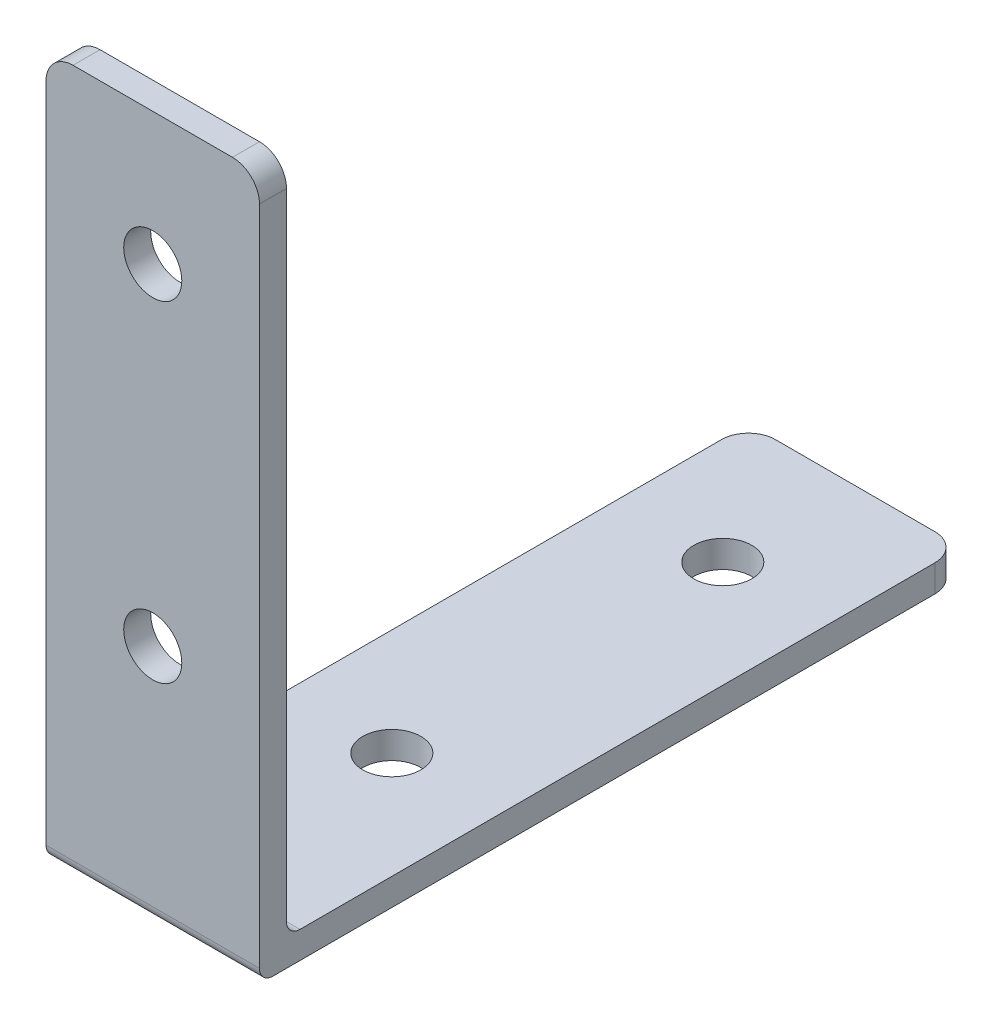
from build123d import *

# Parameters (mm, degrees)
SKETCH_1_W          = 15.8
SKETCH_1_H          = 2
EXTRUDE_1_DEPTH     = 52
SKETCH_2_W          = 15.8
SKETCH_2_H          = 2
EXTRUDE_2_DEPTH     = 50
FILLET_5_R          = 1
FILLET_6_R          = 1
FILLET_7_R          = 2
FILLET_8_R          = 2
SKETCH_3_R          = 2.15
CUT_EXTRUDE_1_DEPTH = 50
SKETCH_8_R          = 2.15
CUT_EXTRUDE_3_DEPTH = 50


with BuildPart() as part:
    # 草圖1 → 填料-伸長1 (new body)
    with BuildSketch(Plane.XY):
        Rectangle(SKETCH_1_W, SKETCH_1_H)
    extrude(amount=EXTRUDE_1_DEPTH)

    # 草圖2 → 填料-伸長2 (add)
    with BuildSketch(Plane(origin=(0, 1, 0), x_dir=(1, 0, 0), z_dir=(0, 1, 0))):
        with Locations((0, -51)):
            Rectangle(SKETCH_2_W, SKETCH_2_H)
    extrude(amount=EXTRUDE_2_DEPTH)

    # 圓角5
    fillet_5_edges = [part.edges().sort_by_distance(p)[0] for p in [
        (0, -1, 52),
    ]]
    fillet(fillet_5_edges, radius=FILLET_5_R)

    # 圓角6
    fillet_6_edges = [part.edges().sort_by_distance(p)[0] for p in [
        (0, 1, 50),
    ]]
    fillet(fillet_6_edges, radius=FILLET_6_R)

    # 圓角7
    fillet_7_edges = [part.edges().sort_by_distance(p)[0] for p in [
        (7.9, 51, 51),
    ]]
    fillet(fillet_7_edges, radius=FILLET_7_R)

    # 圓角8
    fillet_8_edges = [part.edges().sort_by_distance(p)[0] for p in [
        (-7.9, 51, 51),
        (7.9, 0, 0),
        (-7.9, 0, 0),
    ]]
    fillet(fillet_8_edges, radius=FILLET_8_R)

    # 草圖3 → 除料-伸長1 (cut)
    with BuildSketch(Plane(origin=(0, 0, 50), x_dir=(-1, 0, 0), z_dir=(0, 0, -1))):
        with Locations((0, 41.2)):
            Circle(SKETCH_3_R)
        with Locations((0, 16.7)):
            Circle(SKETCH_3_R)
    extrude(amount=-CUT_EXTRUDE_1_DEPTH, mode=Mode.SUBTRACT)

    # 草圖8 → 除料-伸長3 (cut)
    with BuildSketch(Plane(origin=(0, 1, 0), x_dir=(1, 0, 0), z_dir=(0, 1, 0))):
        with Locations(Location((0, -9.8, 0), (0, 0, 180))):
            Circle(SKETCH_8_R)
        with Locations(Location((0, -34.3, 0), (0, 0, 180))):
            Circle(SKETCH_8_R)
    extrude(amount=-CUT_EXTRUDE_3_DEPTH, mode=Mode.SUBTRACT)


solid = part.part
